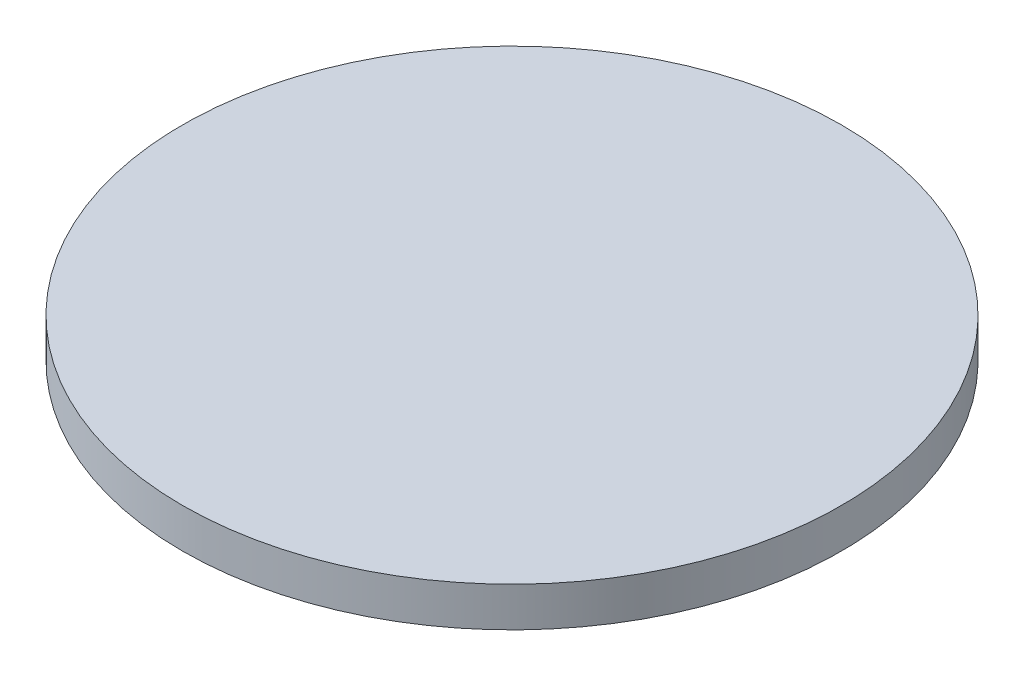
from build123d import *

# Parameters (mm, degrees)
SKETCH1_R           = 2.5
BOSS_EXTRUDE1_DEPTH = 0.3


with BuildPart() as part:
    # Sketch1 → Boss-Extrude1 (new body)
    with BuildSketch(Plane(origin=(0, 0, 0), x_dir=(1, 0, 0), z_dir=(0, 1, 0))):
        with Locations(Location((0, 0.257247878, 0), (0, 0, 270))):
            Circle(SKETCH1_R)
    extrude(amount=BOSS_EXTRUDE1_DEPTH)


solid = part.part
